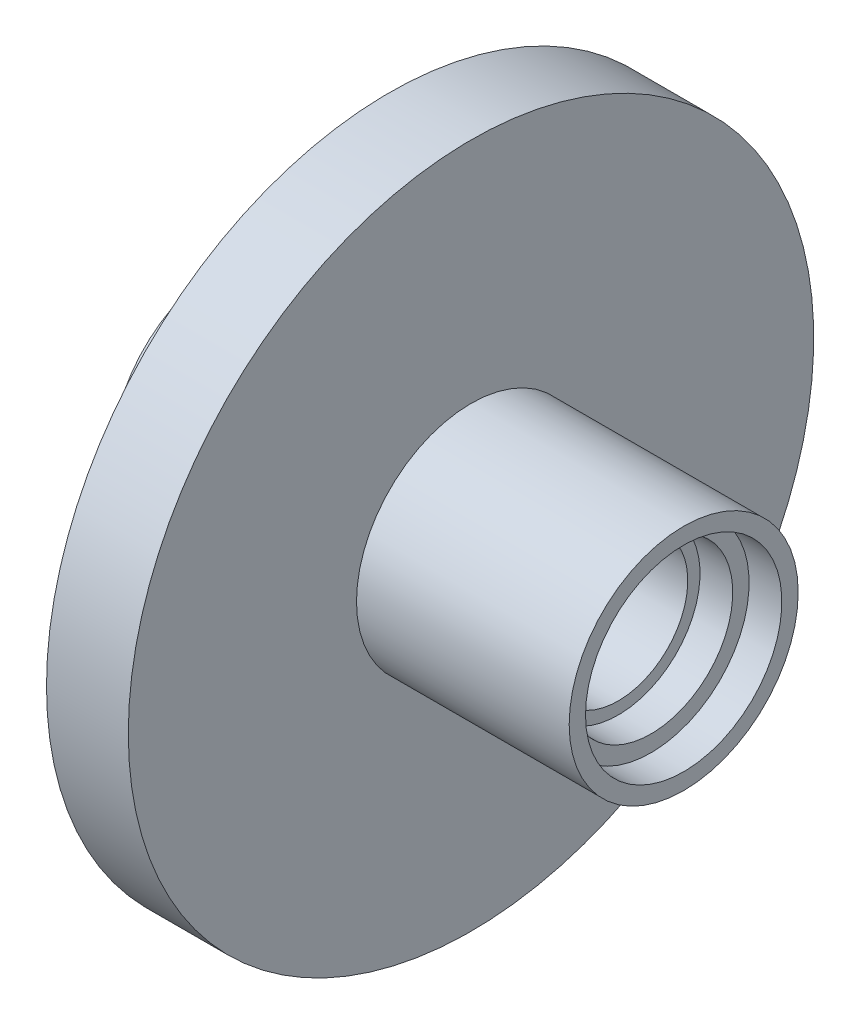
from build123d import *

# Parameters (mm, degrees)
SKETCH2_R              = 1.25
CUT_EXTRUDE_M2_5_DEPTH = 5
CIRPATTERN1_COUNT      = 4


with BuildPart() as part:
    # Sketch1 → Revolve1 (revolve)
    with BuildSketch(Plane.XY, mode=Mode.PRIVATE) as revolve1_sk:
        Polygon((-8.5, 4.25), (-5, 4.25), (-5, 7), (-12.5, 7), (-12.5, 6), (-10.5, 6), (-10.5, 5), (-8.5, 5), align=None)
        Polygon((-2.5, 4.25), (-2.5, 16.5), (-5, 16.5), (-5, 7), (-5, 4.25), align=None)
        Polygon((2.5, 20.95), (-2.5, 20.95), (-2.5, 16.5), (-2.5, 4.25), (2.5, 4.25), (2.5, 7), align=None)
        Polygon((15.5, 7), (2.5, 7), (2.5, 4.25), (11.5, 4.25), (11.5, 5), (13.5, 5), (13.5, 6), (15.5, 6), align=None)
    revolve(revolve1_sk.sketch.rotate(Axis((0, 0, 0), (1, 0, 0)), 90), axis=Axis((0, 0, 0), (1, 0, 0)))

    # Sketch2 → Cut-Extrude M2.5 (cut)
    with BuildSketch(Plane.ZY.offset(5)):
        with Locations((9.192388155, 9.192388155)):
            Circle(SKETCH2_R)
    cut_extrude_m2_5 = extrude(amount=-CUT_EXTRUDE_M2_5_DEPTH, mode=Mode.SUBTRACT)

    # CirPattern1: Cut-Extrude M2.5 ×4 about axis
    cirpattern1_axis = Axis((0, 0, 0), (1, 0, 0))
    for i in range(1, CIRPATTERN1_COUNT):
        add(cut_extrude_m2_5.rotate(cirpattern1_axis, i * 360 / CIRPATTERN1_COUNT), mode=Mode.SUBTRACT)


solid = part.part
